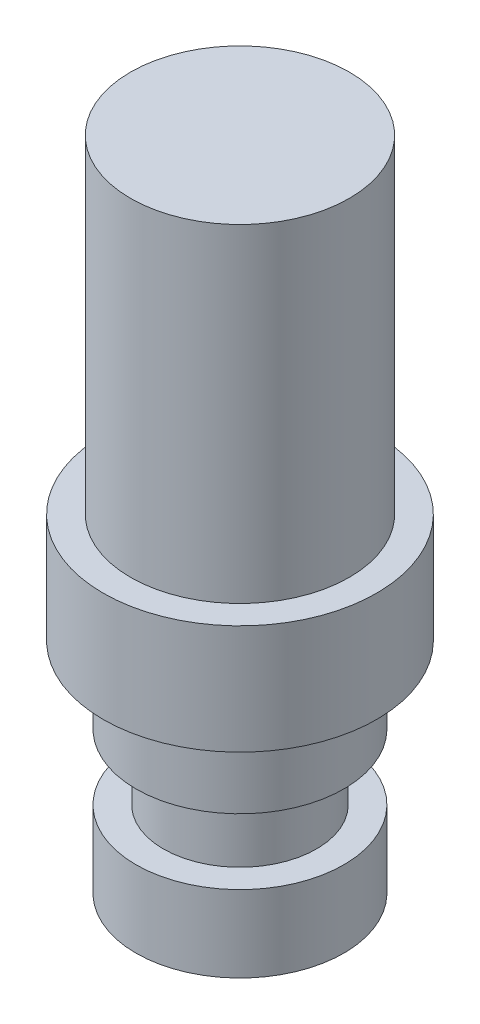
from build123d import *

# Parameters (mm, degrees)
SKETCH_1_R      = 9.5
EXTRUDE_1_DEPTH = 7
EXTRUDE_START   = 7
SKETCH_2_R      = 7
EXTRUDE_2_DEPTH = 6
EXTRUDE_START_2 = 13
SKETCH_3_R      = 9.5
EXTRUDE_3_DEPTH = 7
EXTRUDE_START_3 = 20
SKETCH_4_R      = 12.5
EXTRUDE_4_DEPTH = 10
EXTRUDE_START_4 = 30
SKETCH_5_R      = 10
EXTRUDE_5_DEPTH = 30


with BuildPart() as part:
    # 草图1 → 凸台-拉伸1 (new body)
    with BuildSketch(Plane(origin=(0, 0, 0), x_dir=(1, 0, 0), z_dir=(0, 1, 0))):
        with Locations(Location((0, 0, 0), (0, 0, 270))):
            Circle(SKETCH_1_R)
    extrude(amount=EXTRUDE_1_DEPTH)

    # 草图2 → 凸台-拉伸2 (add)
    with BuildSketch(Plane(origin=(0, 0, 0), x_dir=(1, 0, 0), z_dir=(0, 1, 0)).offset(EXTRUDE_START)):
        with Locations(Location((0, 0, 0), (0, 0, 270))):
            Circle(SKETCH_2_R)
    extrude(amount=EXTRUDE_2_DEPTH)

    # 草图3 → 凸台-拉伸3 (add)
    with BuildSketch(Plane(origin=(0, 0, 0), x_dir=(1, 0, 0), z_dir=(0, 1, 0)).offset(EXTRUDE_START_2)):
        with Locations(Location((0, 0, 0), (0, 0, 270))):
            Circle(SKETCH_3_R)
    extrude(amount=EXTRUDE_3_DEPTH)

    # 草图4 → 凸台-拉伸4 (add)
    with BuildSketch(Plane(origin=(0, 0, 0), x_dir=(1, 0, 0), z_dir=(0, 1, 0)).offset(EXTRUDE_START_3)):
        with Locations(Location((0, 0, 0), (0, 0, 270))):
            Circle(SKETCH_4_R)
    extrude(amount=EXTRUDE_4_DEPTH)

    # 草图5 → 凸台-拉伸5 (add)
    with BuildSketch(Plane(origin=(0, 0, 0), x_dir=(1, 0, 0), z_dir=(0, 1, 0)).offset(EXTRUDE_START_4)):
        with Locations(Location((0, 0, 0), (0, 0, 270))):
            Circle(SKETCH_5_R)
    extrude(amount=EXTRUDE_5_DEPTH)


solid = part.part
